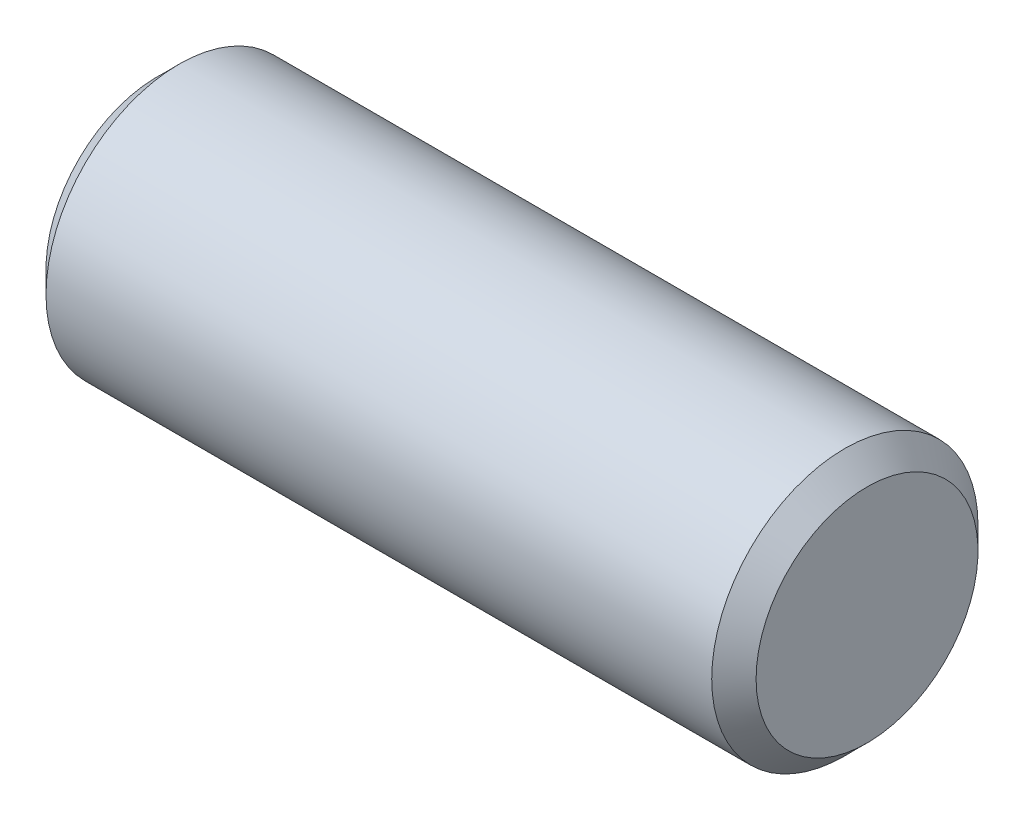
from build123d import *

# Parameters (mm, degrees)
SKETCH1_R           = 4.7625
BOSS_EXTRUDE1_DEPTH = 25.4
CHAMFER1_SIZE       = 0.79375


with BuildPart() as part:
    # Sketch1 → Boss-Extrude1 (new body)
    with BuildSketch(Plane(origin=(0, 0, 0), x_dir=(0, 0, -1), z_dir=(1, 0, 0))):
        Circle(SKETCH1_R)
    extrude(amount=BOSS_EXTRUDE1_DEPTH)

    # Chamfer1
    chamfer1_edges = [part.edges().sort_by_distance(p)[0] for p in [
        (0, 0, 4.7625),
        (25.4, 0, 4.7625),
    ]]
    chamfer(chamfer1_edges, length=CHAMFER1_SIZE)


solid = part.part
